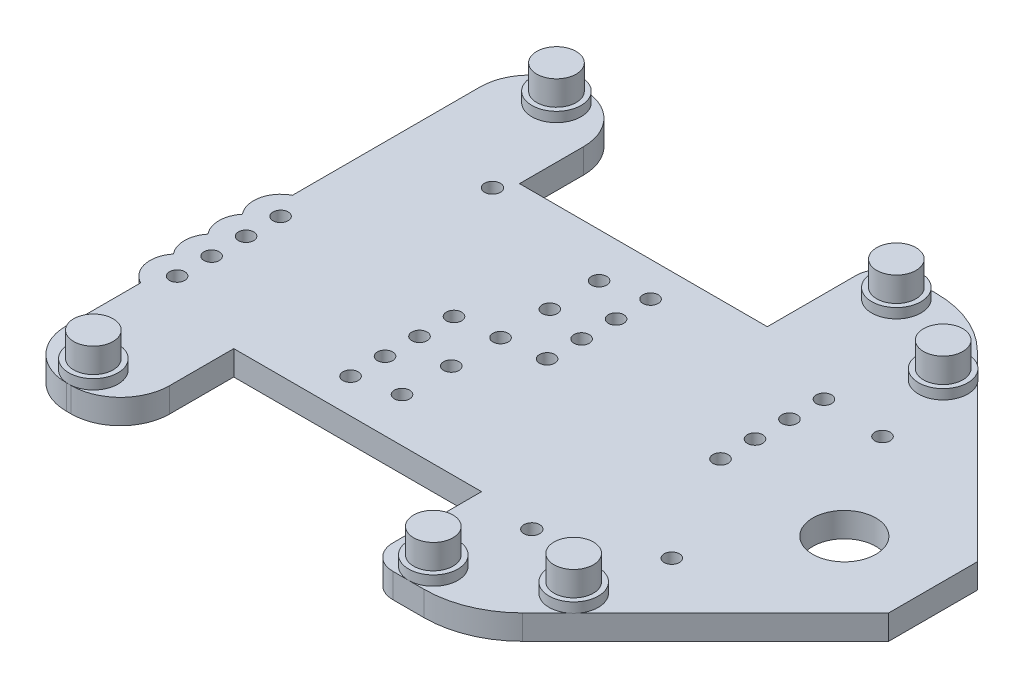
from build123d import *

# Parameters (mm, degrees)
SKETCH1_R           = 1.55
SKETCH1_R_2         = 6.4
SKETCH1_R_3         = 1.605
BOSS_EXTRUDE1_DEPTH = 5
SKETCH3_R           = 3.05
CUT_EXTRUDE1_DEPTH  = 2
BOSS_EXTRUDE3_DEPTH = 5
SKETCH7_R           = 5
BOSS_EXTRUDE4_DEPTH = 2
SKETCH8_R           = 4
BOSS_EXTRUDE5_DEPTH = 5
FILLET1_R           = 10
FILLET2_R           = 5
FILLET3_R           = 20


with BuildPart() as part:
    # Sketch1 → Boss-Extrude1 (new body)
    with BuildSketch(Plane(origin=(0, 0, 0), x_dir=(1, 0, 0), z_dir=(0, 1, 0))):
        with BuildLine():
            Line((28.57509878, 48.821516158), (28.57509878, 67.821516158))
            Line((28.57509878, 67.821516158), (31.202515778, 67.821516158))
            Line((31.202515778, 67.821516158), (70.213351221, 28.810680715))
            Line((70.213351221, 28.810680715), (70.213351221, 10.832351601))
            Line((70.213351221, 10.832351601), (31.202515778, -28.178483842))
            Line((31.202515778, -28.178483842), (28.57509878, -28.178483842))
            Line((28.57509878, -28.178483842), (28.57509878, -9.178483842))
            Line((28.57509878, -9.178483842), (26.27009878, -9.178483842))
            ThreePointArc((26.27009878, -9.178483842), (25.562991999, -9.471377061), (25.27009878, -10.178483842))
            Line((25.27009878, -10.178483842), (25.27009878, -10.673483842))
            ThreePointArc((25.27009878, -10.673483842), (19.27009878, -16.673483842), (13.27009878, -10.673483842))
            Line((13.27009878, -10.673483842), (13.27009878, -10.178483842))
            ThreePointArc((13.27009878, -10.178483842), (12.977205561, -9.471377061), (12.27009878, -9.178483842))
            Line((12.27009878, -9.178483842), (-42.72490122, -9.178483842))
            Line((-42.72490122, -9.178483842), (-42.72490122, -32.178483842))
            Line((-42.72490122, -32.178483842), (-63.72490122, -32.178483842))
            Line((-63.72490122, -32.178483842), (-63.72490122, -7.077463327))
            ThreePointArc((-63.72490122, -7.077463327), (-66.610206686, -3.295840115), (-65.467541907, 1.321516158))
            ThreePointArc((-65.467541907, 1.321516158), (-66.72490122, 4.821516158), (-65.467541907, 8.321516158))
            ThreePointArc((-65.467541907, 8.321516158), (-66.72490122, 11.821516158), (-65.467541907, 15.321516158))
            ThreePointArc((-65.467541907, 15.321516158), (-66.610206686, 19.938872432), (-63.72490122, 23.720495644))
            Line((-63.72490122, 23.720495644), (-63.72490122, 71.821516158))
            Line((-63.72490122, 71.821516158), (-42.72490122, 71.821516158))
            Line((-42.72490122, 71.821516158), (-42.72490122, 48.821516158))
            Line((-42.72490122, 48.821516158), (12.27009878, 48.821516158))
            ThreePointArc((12.27009878, 48.821516158), (12.977205561, 49.114409377), (13.27009878, 49.821516158))
            Line((13.27009878, 49.821516158), (13.27009878, 50.316516158))
            ThreePointArc((13.27009878, 50.316516158), (19.27009878, 56.316516158), (25.27009878, 50.316516158))
            Line((25.27009878, 50.316516158), (25.27009878, 49.821516158))
            ThreePointArc((25.27009878, 49.821516158), (25.562991999, 49.114409377), (26.27009878, 48.821516158))
            Line((26.27009878, 48.821516158), (28.57509878, 48.821516158))
        make_face()
        with Locations(Location((26.07509878, 20.821516158, 0), (0, 0, 270))):
            Circle(SKETCH1_R, mode=Mode.SUBTRACT)
        with Locations(Location((-9.12490122, 20.821516158, 0), (0, 0, 270))):
            Circle(SKETCH1_R, mode=Mode.SUBTRACT)
        with Locations(Location((-9.12490122, 27.821516158, 0), (0, 0, 270))):
            Circle(SKETCH1_R, mode=Mode.SUBTRACT)
        with Locations(Location((26.07509878, 27.821516158, 0), (0, 0, 270))):
            Circle(SKETCH1_R, mode=Mode.SUBTRACT)
        with Locations(Location((-9.12490122, 34.821516158, 0), (0, 0, 270))):
            Circle(SKETCH1_R, mode=Mode.SUBTRACT)
        with Locations(Location((26.07509878, 34.821516158, 0), (0, 0, 270))):
            Circle(SKETCH1_R, mode=Mode.SUBTRACT)
        with Locations(Location((-9.12490122, 41.821516158, 0), (0, 0, 270))):
            Circle(SKETCH1_R, mode=Mode.SUBTRACT)
        with Locations(Location((26.07509878, 41.821516158, 0), (0, 0, 270))):
            Circle(SKETCH1_R, mode=Mode.SUBTRACT)
        with Locations(Location((-26.02490122, -2.178483842, 0), (0, 0, 270))):
            Circle(SKETCH1_R, mode=Mode.SUBTRACT)
        with Locations(Location((-61.22490122, -2.178483842, 0), (0, 0, 270))):
            Circle(SKETCH1_R, mode=Mode.SUBTRACT)
        with Locations(Location((-26.02490122, 4.821516158, 0), (0, 0, 270))):
            Circle(SKETCH1_R, mode=Mode.SUBTRACT)
        with Locations(Location((-61.22490122, 4.821516158, 0), (0, 0, 270))):
            Circle(SKETCH1_R, mode=Mode.SUBTRACT)
        with Locations(Location((-26.02490122, 11.821516158, 0), (0, 0, 270))):
            Circle(SKETCH1_R, mode=Mode.SUBTRACT)
        with Locations(Location((-61.22490122, 11.821516158, 0), (0, 0, 270))):
            Circle(SKETCH1_R, mode=Mode.SUBTRACT)
        with Locations(Location((-26.02490122, 18.821516158, 0), (0, 0, 270))):
            Circle(SKETCH1_R, mode=Mode.SUBTRACT)
        with Locations(Location((-61.22490122, 18.821516158, 0), (0, 0, 270))):
            Circle(SKETCH1_R, mode=Mode.SUBTRACT)
        with Locations(Location((-17.57490122, 39.821516158, 0), (0, 0, 270))):
            Circle(SKETCH1_R, mode=Mode.SUBTRACT)
        with Locations(Location((-17.57490122, 29.821516158, 0), (0, 0, 270))):
            Circle(SKETCH1_R, mode=Mode.SUBTRACT)
        with Locations(Location((-17.57490122, 19.821516158, 0), (0, 0, 270))):
            Circle(SKETCH1_R, mode=Mode.SUBTRACT)
        with Locations(Location((-17.57490122, 9.821516158, 0), (0, 0, 270))):
            Circle(SKETCH1_R, mode=Mode.SUBTRACT)
        with Locations(Location((-17.57490122, -0.178483842, 0), (0, 0, 270))):
            Circle(SKETCH1_R, mode=Mode.SUBTRACT)
        with Locations(Location((52.213351221, 19.821516158, 0), (0, 0, 270))):
            Circle(SKETCH1_R_2, mode=Mode.SUBTRACT)
        with Locations(Location((19.27009878, -10.673483842, 0), (0, 0, 270))):
            Circle(SKETCH1_R_3, mode=Mode.SUBTRACT)
        with Locations(Location((-44.73990122, 45.346516158, 0), (0, 0, 270))):
            Circle(SKETCH1_R_3, mode=Mode.SUBTRACT)
        with Locations(Location((38.57509878, 41.206292469, 0), (0, 0, 270))):
            Circle(SKETCH1_R, mode=Mode.SUBTRACT)
        with Locations(Location((38.57509878, -1.563260153, 0), (0, 0, 270))):
            Circle(SKETCH1_R, mode=Mode.SUBTRACT)
    extrude(amount=BOSS_EXTRUDE1_DEPTH)

    # Sketch3 → Cut-Extrude1 (cut)
    with BuildSketch(Plane(origin=(0, 0, 0), x_dir=(-1, 0, 0), z_dir=(0, -1, 0))):
        with Locations(Location((61.22490122, -2.178483842, 0), (0, 0, 90))):
            Circle(SKETCH3_R)
        with Locations(Location((61.22490122, 4.821516158, 0), (0, 0, 90))):
            Circle(SKETCH3_R)
        with Locations(Location((61.22490122, 11.821516158, 0), (0, 0, 90))):
            Circle(SKETCH3_R)
        with Locations(Location((61.22490122, 18.821516158, 0), (0, 0, 90))):
            Circle(SKETCH3_R)
        with Locations(Location((26.02490122, -2.178483842, 0), (0, 0, 90))):
            Circle(SKETCH3_R)
        with Locations(Location((26.02490122, 4.821516158, 0), (0, 0, 90))):
            Circle(SKETCH3_R)
        with Locations(Location((26.02490122, 11.821516158, 0), (0, 0, 90))):
            Circle(SKETCH3_R)
        with Locations(Location((26.02490122, 18.821516158, 0), (0, 0, 90))):
            Circle(SKETCH3_R)
        with Locations(Location((17.57490122, -0.178483842, 0), (0, 0, 90))):
            Circle(SKETCH3_R)
        with Locations(Location((17.57490122, 9.821516158, 0), (0, 0, 90))):
            Circle(SKETCH3_R)
        with Locations(Location((17.57490122, 19.821516158, 0), (0, 0, 90))):
            Circle(SKETCH3_R)
        with Locations(Location((17.57490122, 29.821516158, 0), (0, 0, 90))):
            Circle(SKETCH3_R)
        with Locations(Location((17.57490122, 39.821516158, 0), (0, 0, 90))):
            Circle(SKETCH3_R)
        with Locations(Location((9.12490122, 20.821516158, 0), (0, 0, 90))):
            Circle(SKETCH3_R)
        with Locations(Location((9.12490122, 27.821516158, 0), (0, 0, 90))):
            Circle(SKETCH3_R)
        with Locations(Location((9.12490122, 34.821516158, 0), (0, 0, 90))):
            Circle(SKETCH3_R)
        with Locations(Location((9.12490122, 41.821516158, 0), (0, 0, 90))):
            Circle(SKETCH3_R)
        with Locations(Location((-26.07509878, 20.821516158, 0), (0, 0, 90))):
            Circle(SKETCH3_R)
        with Locations(Location((-26.07509878, 27.821516158, 0), (0, 0, 90))):
            Circle(SKETCH3_R)
        with Locations(Location((-26.07509878, 34.821516158, 0), (0, 0, 90))):
            Circle(SKETCH3_R)
        with Locations(Location((-26.07509878, 41.821516158, 0), (0, 0, 90))):
            Circle(SKETCH3_R)
        with Locations(Location((-19.27009878, -10.673483842, 0), (0, 0, 90))):
            Circle(SKETCH3_R)
        with Locations(Location((44.73990122, 45.346516158, 0), (0, 0, 90))):
            Circle(SKETCH3_R)
        with Locations(Location((-38.57509878, 41.206292469, 0), (0, 0, 90))):
            Circle(SKETCH3_R)
        with Locations(Location((-38.57509878, -1.563260153, 0), (0, 0, 90))):
            Circle(SKETCH3_R)
    extrude(amount=-CUT_EXTRUDE1_DEPTH, mode=Mode.SUBTRACT)

    # Sketch6 → Boss-Extrude3 (add)
    with BuildSketch(Plane(origin=(0, 0, 0), x_dir=(-1, 0, 0), z_dir=(0, -1, 0))):
        with BuildLine():
            Line((-7.57509878, -9.178483842), (-7.57509878, -32.178483842))
            Line((-7.57509878, -32.178483842), (-27.202515778, -32.178483842))
            Line((-27.202515778, -32.178483842), (-31.202515778, -28.178483842))
            Line((-31.202515778, -28.178483842), (-28.57509878, -28.178483842))
            Line((-28.57509878, -28.178483842), (-28.57509878, -9.178483842))
            Line((-28.57509878, -9.178483842), (-26.25257506, -9.178483842))
            ThreePointArc((-26.25257506, -9.178483842), (-25.520894021, -9.496836677), (-25.255078449, -10.249198127))
            ThreePointArc((-25.255078449, -10.249198127), (-19.27009878, -16.673483842), (-13.285119112, -10.249198127))
            ThreePointArc((-13.285119112, -10.249198127), (-13.019303539, -9.496836677), (-12.2876225, -9.178483842))
            Line((-12.2876225, -9.178483842), (-7.57509878, -9.178483842))
        make_face()
        with BuildLine():
            Line((-7.57509878, 48.821516158), (-12.2876225, 48.821516158))
            ThreePointArc((-12.2876225, 48.821516158), (-13.019303539, 49.139868994), (-13.285119112, 49.892230444))
            ThreePointArc((-13.285119112, 49.892230444), (-19.27009878, 56.316516158), (-25.255078449, 49.892230444))
            ThreePointArc((-25.255078449, 49.892230444), (-25.520894021, 49.139868994), (-26.25257506, 48.821516158))
            Line((-26.25257506, 48.821516158), (-28.57509878, 48.821516158))
            Line((-28.57509878, 48.821516158), (-28.57509878, 67.821516158))
            Line((-28.57509878, 67.821516158), (-31.202515778, 67.821516158))
            Line((-31.202515778, 67.821516158), (-27.202515778, 71.821516158))
            Line((-27.202515778, 71.821516158), (-7.57509878, 71.821516158))
            Line((-7.57509878, 71.821516158), (-7.57509878, 48.821516158))
        make_face()
    extrude(amount=-BOSS_EXTRUDE3_DEPTH)

    # Sketch7 → Boss-Extrude4 (add)
    with BuildSketch(Plane(origin=(0, 5, 0), x_dir=(1, 0, 0), z_dir=(0, 1, 0))):
        with Locations(Location((-53.22490122, 66.821516158, 0), (0, 0, 90))):
            Circle(SKETCH7_R)
        with Locations(Location((-53.22490122, -27.178483842, 0), (0, 0, 90))):
            Circle(SKETCH7_R)
        with Locations(Location((15.77509878, 66.821516158, 0), (0, 0, 90))):
            Circle(SKETCH7_R)
        with Locations(Location((15.77509878, -27.178483842, 0), (0, 0, 90))):
            Circle(SKETCH7_R)
        with Locations(Location((34.77509878, 57.321516158, 0), (0, 0, 56.568769374))):
            Circle(SKETCH7_R)
        with Locations(Location((34.77509878, -17.678483842, 0), (0, 0, 90))):
            Circle(SKETCH7_R)
    extrude(amount=BOSS_EXTRUDE4_DEPTH)

    # Sketch8 → Boss-Extrude5 (add)
    with BuildSketch(Plane(origin=(0, 7, 0), x_dir=(1, 0, 0), z_dir=(0, 1, 0))):
        with Locations(Location((-53.22490122, 66.821516158, 0), (0, 0, 270))):
            Circle(SKETCH8_R)
        with Locations(Location((-53.22490122, -27.178483842, 0), (0, 0, 90))):
            Circle(SKETCH8_R)
        with Locations(Location((15.77509878, 66.821516158, 0), (0, 0, 270))):
            Circle(SKETCH8_R)
        with Locations(Location((15.77509878, -27.178483842, 0), (0, 0, 90))):
            Circle(SKETCH8_R)
        with Locations(Location((34.77509878, 57.321516158, 0), (0, 0, 270))):
            Circle(SKETCH8_R)
        with Locations(Location((34.77509878, -17.678483842, 0), (0, 0, 270))):
            Circle(SKETCH8_R)
    extrude(amount=BOSS_EXTRUDE5_DEPTH)

    # Fillet1
    fillet1_edges = [part.edges().sort_by_distance(p)[0] for p in [
        (-42.72490122, 2.5, 32.178483842),
        (-63.72490122, 2.5, 32.178483842),
        (-63.72490122, 2.5, -71.821516158),
        (-42.72490122, 2.5, -71.821516158),
    ]]
    fillet(fillet1_edges, radius=FILLET1_R)

    # Fillet2
    fillet2_edges = [part.edges().sort_by_distance(p)[0] for p in [
        (7.57509878, 2.5, 32.178483842),
        (7.57509878, 2.5, -71.821516158),
    ]]
    fillet(fillet2_edges, radius=FILLET2_R)

    # Fillet3
    fillet3_edges = [part.edges().sort_by_distance(p)[0] for p in [
        (27.202515778, 2.5, 32.178483842),
        (27.202515778, 2.5, -71.821516158),
    ]]
    fillet(fillet3_edges, radius=FILLET3_R)


solid = part.part
